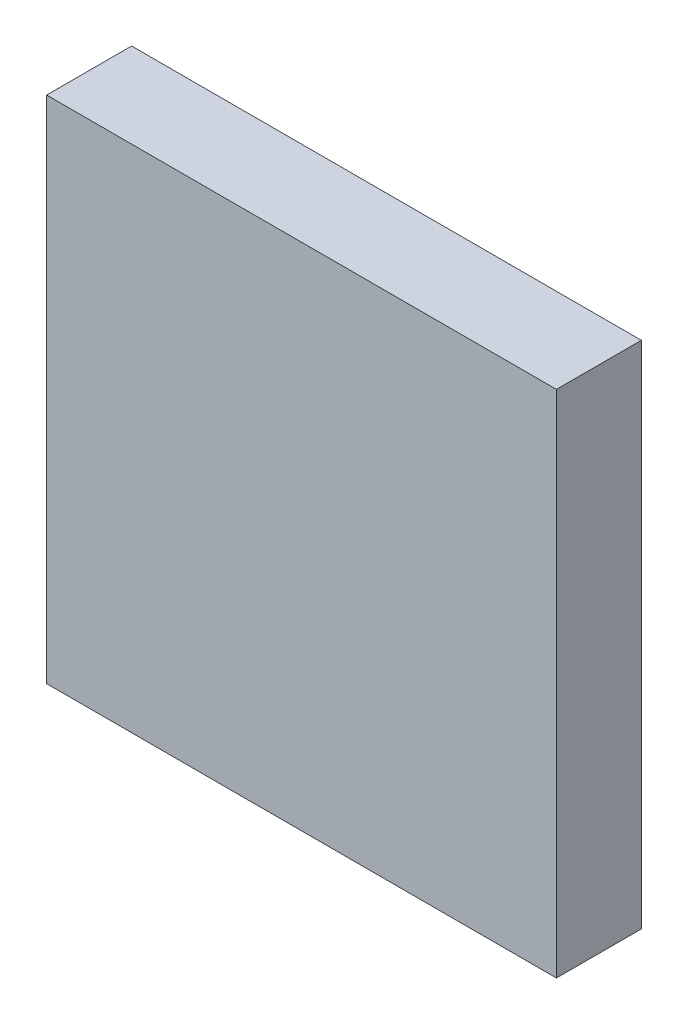
from build123d import *

# Parameters (mm, degrees)
ESQUISSE1_W        = 12
ESQUISSE1_H        = 12
BOSS_EXTRU_1_DEPTH = 2
ESQUISSE2_W        = 4
ESQUISSE2_H        = 4
BOSS_EXTRU_2_DEPTH = 4


with BuildPart() as part:
    # Esquisse1 → Boss.-Extru.1 (new body)
    with BuildSketch(Plane.XY):
        Rectangle(ESQUISSE1_W, ESQUISSE1_H)
    extrude(amount=BOSS_EXTRU_1_DEPTH)

    # Esquisse2 → Boss.-Extru.2 (add)
    with BuildSketch(Plane(origin=(0, 0, 0), x_dir=(-1, 0, 0), z_dir=(0, 0, -1))):
        Rectangle(ESQUISSE2_W, ESQUISSE2_H)
    extrude(amount=BOSS_EXTRU_2_DEPTH)


solid = part.part
